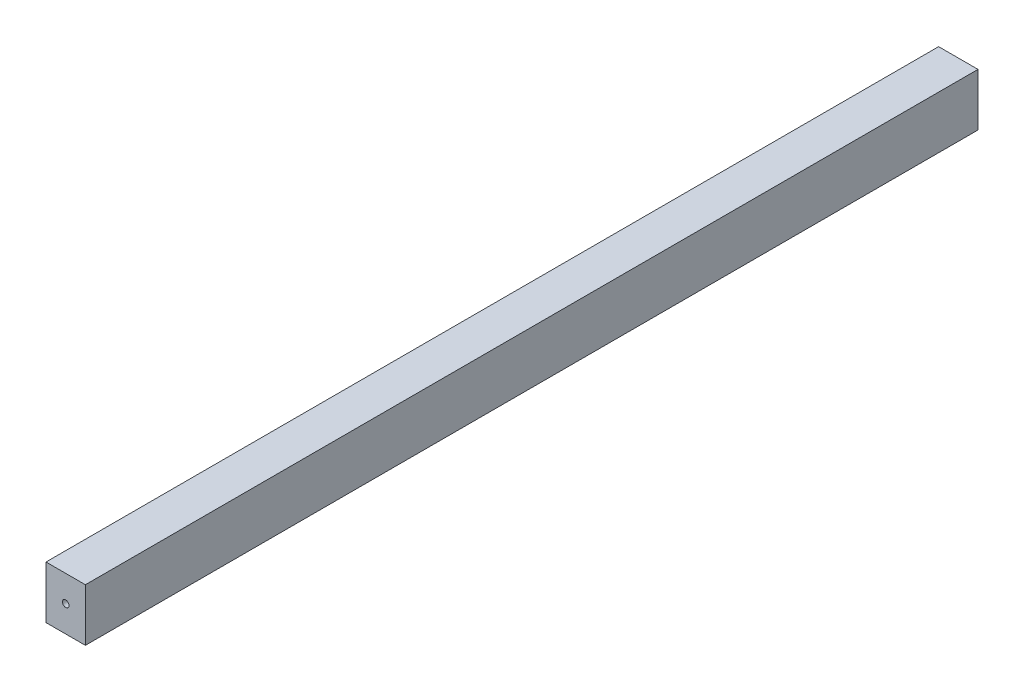
from build123d import *

# Parameters (mm, degrees)
SKETCH1_W           = 38.1
SKETCH1_H           = 50.8
SKETCH1_R           = 3.175
BOSS_EXTRUDE1_DEPTH = 863.6


with BuildPart() as part:
    # Sketch1 → Boss-Extrude1 (new body)
    with BuildSketch(Plane.XY):
        with Locations((19.05, 25.4)):
            Rectangle(SKETCH1_W, SKETCH1_H)
        with Locations((19.05, 25.4)):
            Circle(SKETCH1_R, mode=Mode.SUBTRACT)
    extrude(amount=BOSS_EXTRUDE1_DEPTH)


solid = part.part
